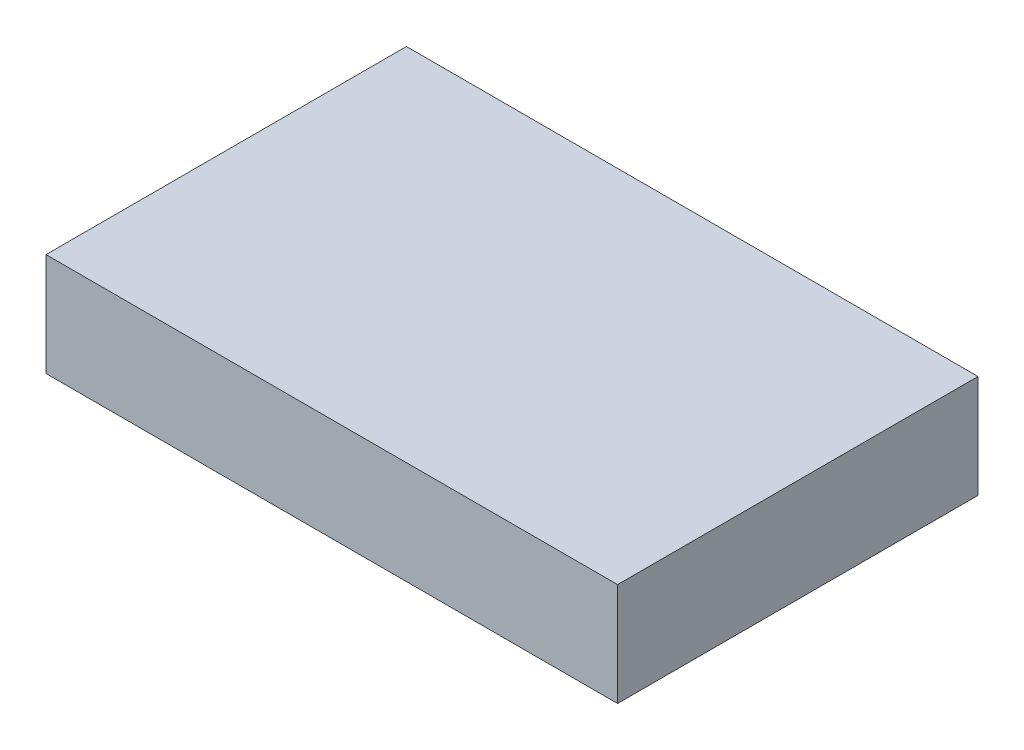
from build123d import *

# Parameters (mm, degrees)
SKETCH_1_W      = 111
SKETCH_1_H      = 70
EXTRUDE_1_DEPTH = 20


with BuildPart() as part:
    # 草图1 → 凸台-拉伸1 (new body)
    with BuildSketch(Plane(origin=(0, 0, 0), x_dir=(1, 0, 0), z_dir=(0, 1, 0))):
        with Locations((55.5, -35)):
            Rectangle(SKETCH_1_W, SKETCH_1_H)
    extrude(amount=EXTRUDE_1_DEPTH)


solid = part.part
